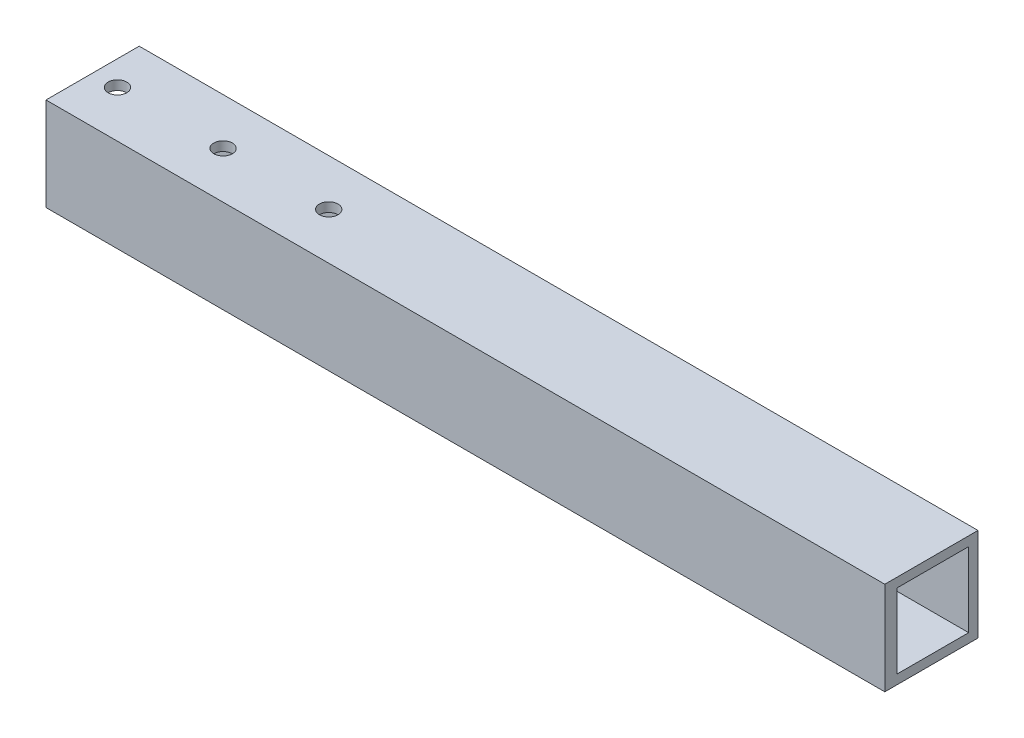
from build123d import *

# Parameters (mm, degrees)
MEMBER_15_15_1_5_1_DEPTH = 135
SKETCH_4_R               = 1.5
CUT_EXTRUDE_1_DEPTH      = 137.037678604


with BuildPart() as part:
    # Sketch1 → Member 15 _15_ 1.5_1 (new body)
    with BuildSketch(Plane(origin=(0, 0, 0), x_dir=(0, 0, -1), z_dir=(1, 0, 0))):
        Polygon((-6, -7.5), (6, -7.5), (7.5, -7.5), (7.5, -6), (7.5, 6), (7.5, 7.5), (6, 7.5), (-6, 7.5), (-7.5, 7.5), (-7.5, 6), (-7.5, -6), (-7.5, -7.5), align=None)
        Polygon((-4, -6), (4, -6), (6, -6), (6, -3.5), (6, 3.5), (6, 6), (3.5, 6), (-3.5, 6), (-5.5, 6), (-5.5, 3.5), (-5.5, -3.5), (-5.5, -6), align=None, mode=Mode.SUBTRACT)
    extrude(amount=MEMBER_15_15_1_5_1_DEPTH)

    # 草图4 → 切除-拉伸1 (cut, through all)
    with BuildSketch(Plane.XZ.offset(7.5)):
        with Locations(Location((38, 0, 0), (0, 0, 270))):
            Circle(SKETCH_4_R)
        with Locations(Location((4, 0, 0), (0, 0, 270))):
            Circle(SKETCH_4_R)
        with Locations(Location((21, 0, 0), (0, 0, 270))):
            Circle(SKETCH_4_R)
    extrude(amount=-CUT_EXTRUDE_1_DEPTH, mode=Mode.SUBTRACT)


solid = part.part
